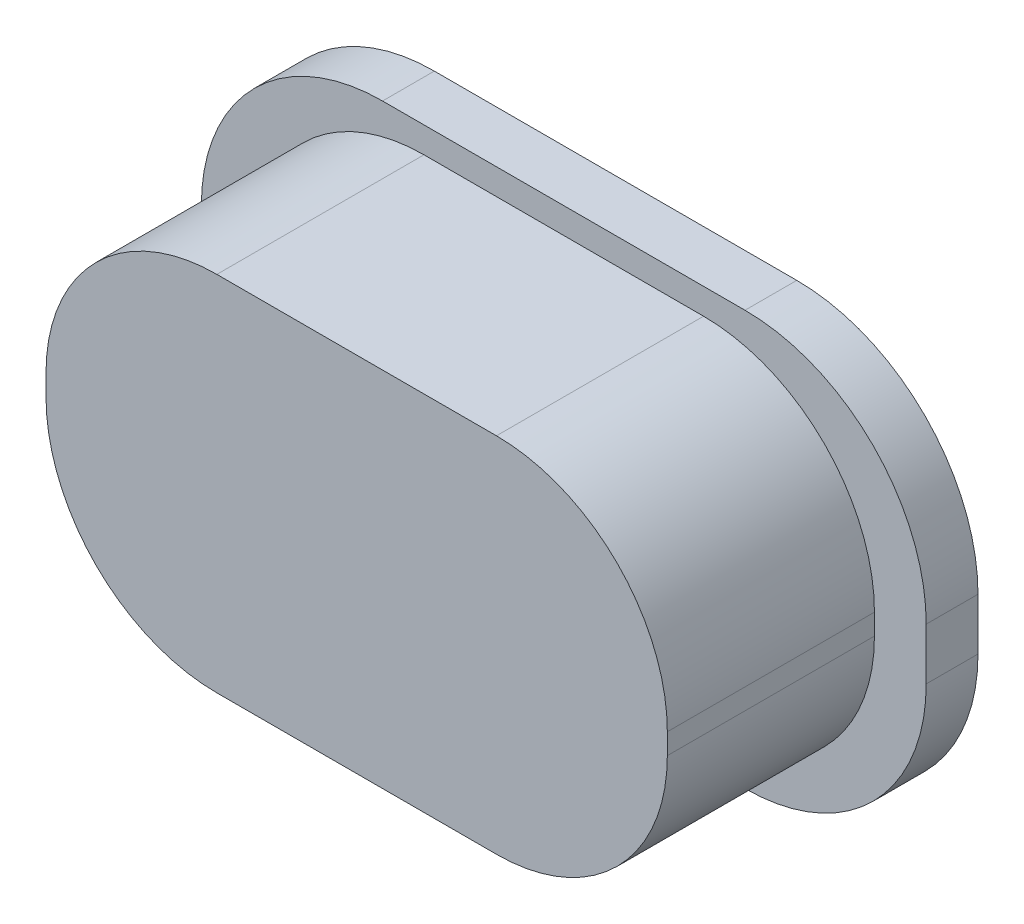
from build123d import *

# Parameters (mm, degrees)
SKETCH1_W           = 14
SKETCH1_H           = 8
BOSS_EXTRUDE1_DEPTH = 1
SKETCH2_W           = 12
SKETCH2_H           = 7
BOSS_EXTRUDE2_DEPTH = 4
FILLET2_R           = 3.3
FILLET1_R           = 3.5


with BuildPart() as part:
    # Sketch1 → Boss-Extrude1 (new body)
    with BuildSketch(Plane.XY):
        Rectangle(SKETCH1_W, SKETCH1_H)
    extrude(amount=BOSS_EXTRUDE1_DEPTH)

    # Sketch2 → Boss-Extrude2 (add)
    with BuildSketch(Plane.XY.offset(1)):
        Rectangle(SKETCH2_W, SKETCH2_H)
    extrude(amount=BOSS_EXTRUDE2_DEPTH)

    # Fillet2
    fillet2_edges = [part.edges().sort_by_distance(p)[0] for p in [
        (6, -3.5, 3),
        (6, 3.5, 3),
        (-6, 3.5, 3),
        (-6, -3.5, 3),
    ]]
    fillet(fillet2_edges, radius=FILLET2_R)

    # Fillet1
    fillet1_edges = [part.edges().sort_by_distance(p)[0] for p in [
        (7, -4, 0.5),
        (-7, -4, 0.5),
        (-7, 4, 0.5),
        (7, 4, 0.5),
    ]]
    fillet(fillet1_edges, radius=FILLET1_R)


solid = part.part
